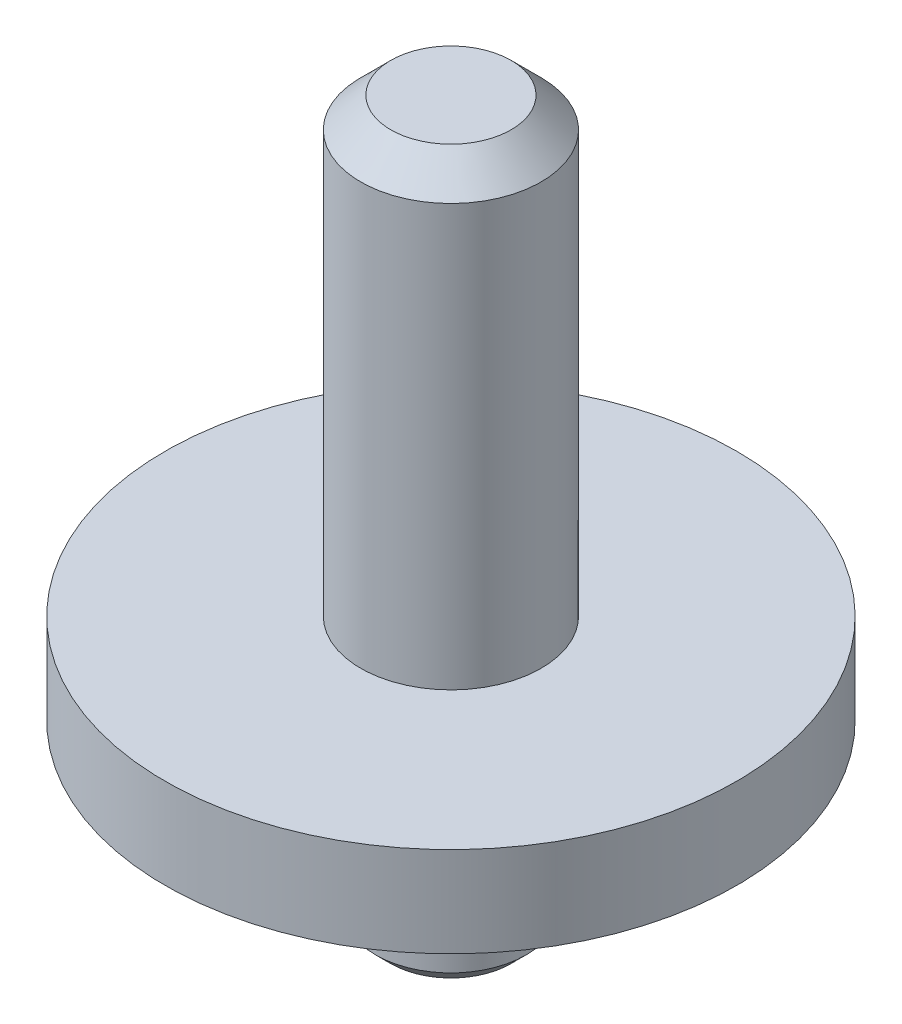
from build123d import *

# Parameters (mm, degrees)
CHAMFER1_SIZE = 1
CHAMFER2_SIZE = 2


with BuildPart() as part:
    # Sketch1 → Revolve1 (revolve)
    with BuildSketch(Plane.XY, mode=Mode.PRIVATE) as revolve1_sk:
        Polygon((0, 41.725973007), (-6, 41.725973007), (-6, 11.725973007), (-19, 11.725973007), (-19, 5.725973007), (-15, 5.725973007), (-15, 8.725973007), (-5, 8.725973007), (-5, -6.274026993), (0, -6.274026993), align=None)
    revolve(revolve1_sk.sketch.rotate(Axis((0, 0, 0), (0, 1, 0)), 270), axis=Axis((0, 0, 0), (0, 1, 0)))

    # Chamfer1
    chamfer1_edges = [part.edges().sort_by_distance(p)[0] for p in [
        (0, -6.274026993, 5),
    ]]
    chamfer(chamfer1_edges, length=CHAMFER1_SIZE)

    # Chamfer2
    chamfer2_edges = [part.edges().sort_by_distance(p)[0] for p in [
        (0, 41.725973007, 6),
    ]]
    chamfer(chamfer2_edges, length=CHAMFER2_SIZE)


solid = part.part
